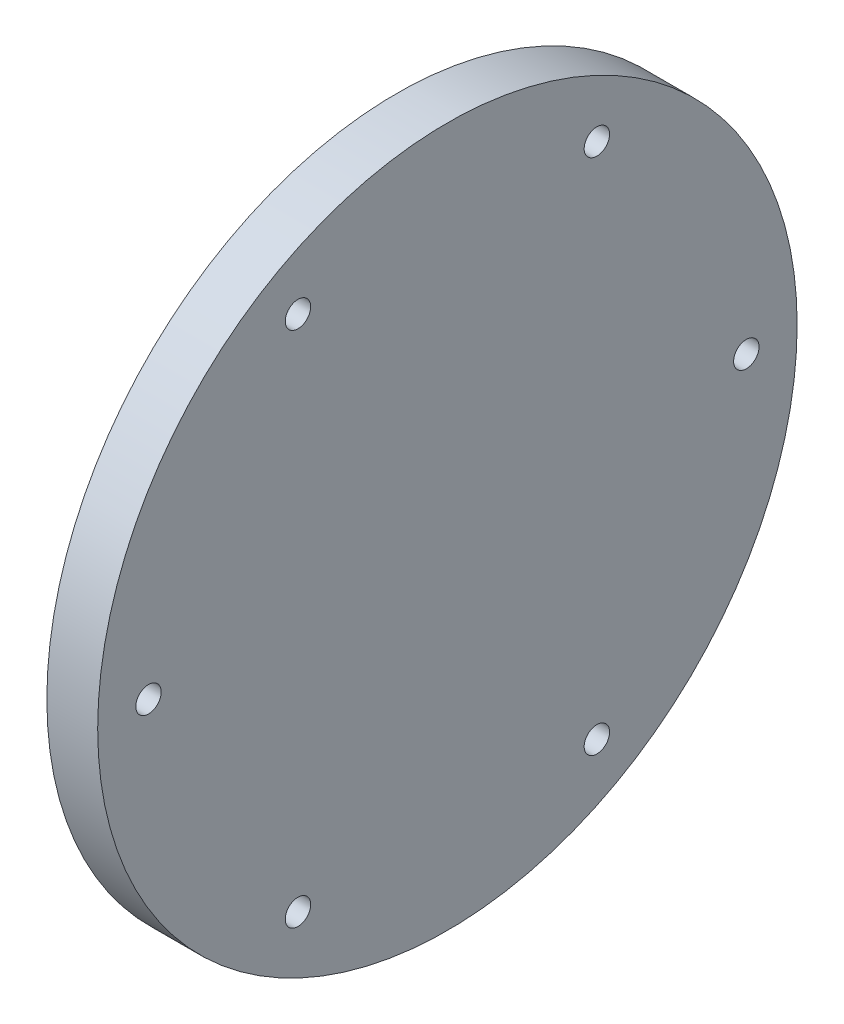
from build123d import *

# Parameters (mm, degrees)
AXIAL_PROFILE_MM_W     = 5
AXIAL_PROFILE_MM_H     = 34.4
AXIAL_HOLES_DEPTH      = 176.574514096
AXIAL_HOLES_DEPTH_BACK = 176.574514096
SKETCH2_R              = 1.25


with BuildPart() as part:
    # Axial profile (mm) → Full revolution (revolve)
    with BuildSketch(Plane.XY, mode=Mode.PRIVATE) as full_revolution_sk:
        with Locations((166.2, 17.2)):
            Rectangle(AXIAL_PROFILE_MM_W, AXIAL_PROFILE_MM_H)
    revolve(full_revolution_sk.sketch.rotate(Axis((-110, 0, 0), (1, 0, 0)), 90), axis=Axis((-110, 0, 0), (1, 0, 0)))

    # Sketch2 → Axial holes (cut, two sides: drawn at the far end of the back side and taken through both)
    with BuildSketch(Plane(origin=(0, 0, 0), x_dir=(0, 0, -1), z_dir=(1, 0, 0)).offset(-AXIAL_HOLES_DEPTH_BACK)):
        with Locations((-29.4, 0)):
            Circle(SKETCH2_R)
        with Locations((14.7, -25.461146871)):
            Circle(SKETCH2_R)
        with Locations((14.7, 25.461146871)):
            Circle(SKETCH2_R)
        with Locations((29.4, 0)):
            Circle(SKETCH2_R)
        with Locations((-14.7, 25.461146871)):
            Circle(SKETCH2_R)
        with Locations((-14.7, -25.461146871)):
            Circle(SKETCH2_R)
    extrude(amount=AXIAL_HOLES_DEPTH + AXIAL_HOLES_DEPTH_BACK, mode=Mode.SUBTRACT)


solid = part.part
